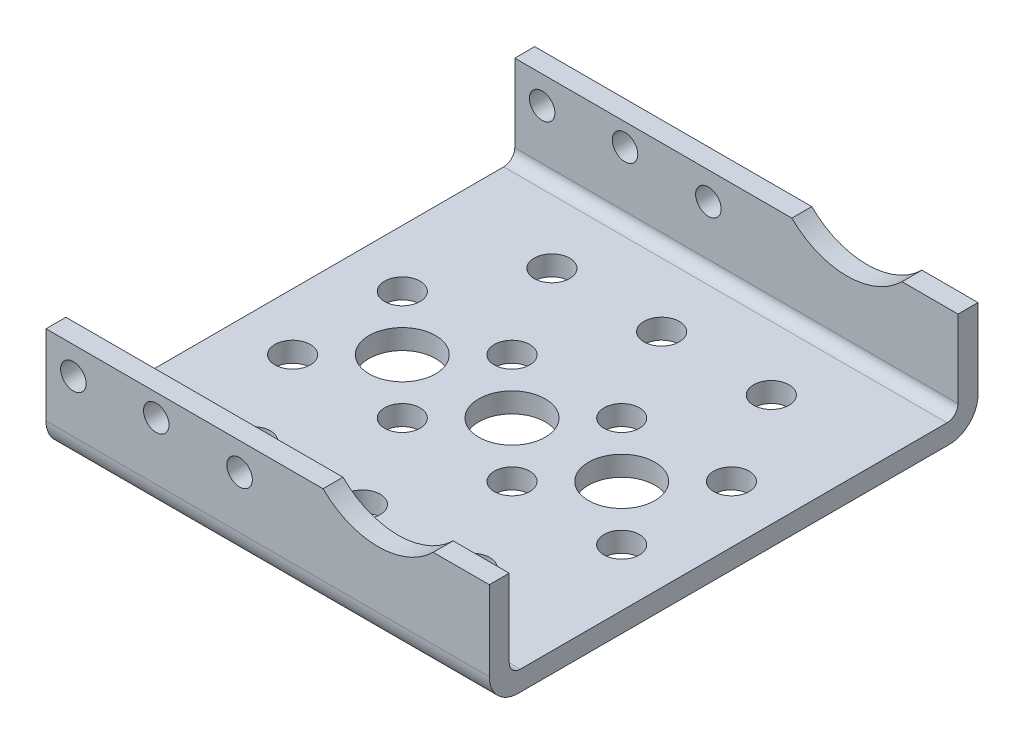
from build123d import *

# Parameters (mm, degrees)
BOSS_EXTRUDE1_DEPTH     = 40
CUT_EXTRUDE1_DEPTH      = 13
CUT_EXTRUDE1_DEPTH_BACK = 50
SKETCH12_R              = 1.150000001
SKETCH14_R              = 1.150000001
CUT_EXTRUDE2_DEPTH      = 50
SKETCH15_R              = 1.150000001
CUT_EXTRUDE3_DEPTH      = 50
SKETCH18_R              = 7.063467882
CUT_EXTRUDE6_DEPTH      = 50
CUT_EXTRUDE8_DEPTH      = 50
CUT_EXTRUDE8_DEPTH_BACK = 50
SKETCH19_R              = 1.6
SKETCH19_R_2            = 2.999999999


with BuildPart() as part:
    # Sketch9 → Boss-Extrude1 (new body)
    with BuildSketch(Plane(origin=(23635.895639599, 0, 0), x_dir=(0, 0, -1), z_dir=(1, 0, 0))):
        with BuildLine():
            Line((44.099999999, 2015.086397777), (44.099999999, 2022.286397779))
            Line((44.099999999, 2022.286397779), (42.3, 2022.286397779))
            Line((42.3, 2022.286397779), (42.3, 2015.286397778))
            ThreePointArc((42.3, 2015.286397778), (42.007106781, 2014.579290998), (41.300000001, 2014.286397779))
            Line((41.300000001, 2014.286397779), (2.800000001, 2014.286397779))
            ThreePointArc((2.800000001, 2014.286397779), (2.092893219, 2014.579290997), (1.799999999, 2015.286397778))
            Line((1.799999999, 2015.286397778), (1.799999999, 2022.286397779))
            Line((1.799999999, 2022.286397779), (0, 2022.286397779))
            Line((0, 2022.286397779), (0, 2015.086397777))
            ThreePointArc((0, 2015.086397777), (0.761522369, 2013.247920146), (2.599999999, 2012.486397778))
            Line((2.599999999, 2012.486397778), (41.5, 2012.486397778))
            ThreePointArc((41.5, 2012.486397778), (43.33847763, 2013.247920146), (44.099999999, 2015.086397777))
        make_face()
    extrude(amount=-BOSS_EXTRUDE1_DEPTH)

    # Sketch12 → Cut-Extrude1 (cut, two sides: drawn at the far end of the back side and taken through both)
    with BuildSketch(Plane.XY.offset(-CUT_EXTRUDE1_DEPTH_BACK)):
        with Locations((23613.365202112, 2019.805962196)):
            Circle(SKETCH12_R)
    extrude(amount=CUT_EXTRUDE1_DEPTH + CUT_EXTRUDE1_DEPTH_BACK, mode=Mode.SUBTRACT)

    # Sketch14 → Cut-Extrude2 (cut)
    with BuildSketch(Plane.XY):
        with Locations((23605.845202113, 2020.305962197)):
            Circle(SKETCH14_R)
    extrude(amount=-CUT_EXTRUDE2_DEPTH, mode=Mode.SUBTRACT)

    # Sketch15 → Cut-Extrude3 (cut)
    with BuildSketch(Plane.XY):
        with Locations((23598.365202112, 2019.805962196)):
            Circle(SKETCH15_R)
    extrude(amount=-CUT_EXTRUDE3_DEPTH, mode=Mode.SUBTRACT)

    # Sketch18 → Cut-Extrude6 (cut)
    with BuildSketch(Plane.XY):
        with Locations((23625.865202113, 2027.305962196)):
            Circle(SKETCH18_R)
    extrude(amount=-CUT_EXTRUDE6_DEPTH, mode=Mode.SUBTRACT)

    # Sketch19 → Cut-Extrude8 (cut, two sides: drawn at the far end of the back side and taken through both)
    with BuildSketch(Plane(origin=(0, 2012.486397778, 0), x_dir=(-1, 0, 0), z_dir=(0, 1, 0)).offset(-CUT_EXTRUDE8_DEPTH_BACK)):
        with Locations((-23605.996144663, -8.550000002)):
            Circle(SKETCH19_R)
        with Locations((-23615.895639599, -8.550000002)):
            Circle(SKETCH19_R)
        with Locations((-23625.795134534, -8.550000002)):
            Circle(SKETCH19_R)
        with Locations((-23630.744882003, -17.100252533)):
            Circle(SKETCH19_R)
        with Locations((-23620.845387068, -17.100252533)):
            Circle(SKETCH19_R)
        with Locations((-23610.94589213, -17.100252533)):
            Circle(SKETCH19_R)
        with Locations((-23601.046397194, -17.100252533)):
            Circle(SKETCH19_R)
        with Locations((-23601.046397194, -26.999747469)):
            Circle(SKETCH19_R)
        with Locations((-23610.94589213, -26.999747469)):
            Circle(SKETCH19_R)
        with Locations((-23620.845387068, -26.999747469)):
            Circle(SKETCH19_R)
        with Locations((-23630.744882003, -26.999747469)):
            Circle(SKETCH19_R)
        with Locations((-23625.795134534, -35.550000002)):
            Circle(SKETCH19_R)
        with Locations((-23615.895639599, -35.550000002)):
            Circle(SKETCH19_R)
        with Locations((-23605.996144663, -35.550000002)):
            Circle(SKETCH19_R)
        with Locations((-23615.895639599, -22.050000002)):
            Circle(SKETCH19_R_2)
        with Locations((-23625.795134534, -22.050000002)):
            Circle(SKETCH19_R_2)
        with Locations((-23605.996144663, -22.050000002)):
            Circle(SKETCH19_R_2)
    extrude(amount=CUT_EXTRUDE8_DEPTH + CUT_EXTRUDE8_DEPTH_BACK, mode=Mode.SUBTRACT)


solid = part.part
